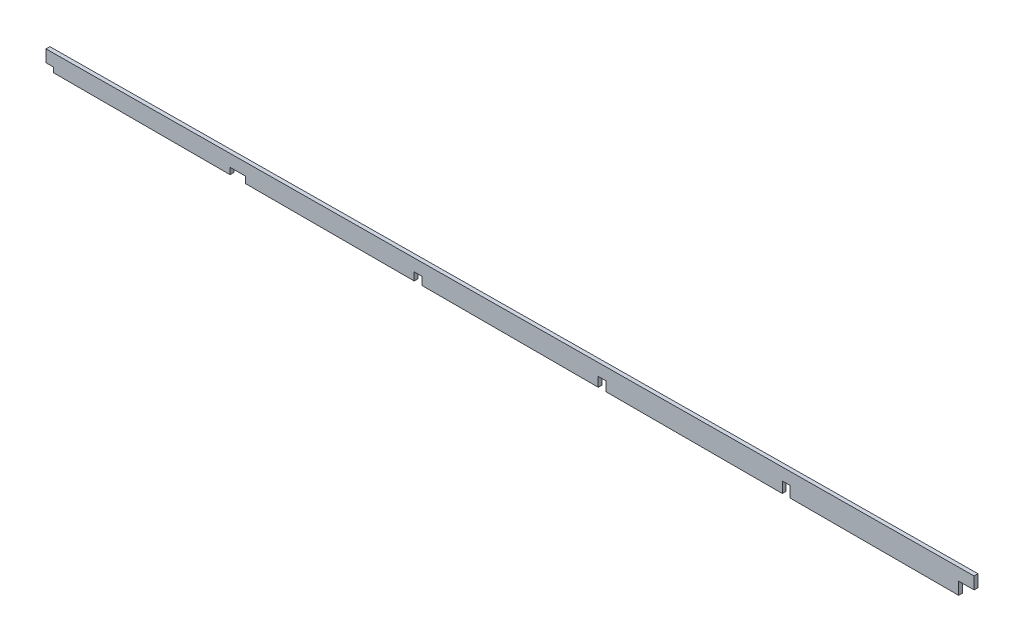
from build123d import *

# Parameters (mm, degrees)
BOSS_EXTRUDE2_DEPTH = 1.5875


with BuildPart() as part:
    # Sketch1 → Boss-Extrude2 (new body)
    with BuildSketch(Plane.XY):
        Polygon((88.325552841, -0.566216396), (88.325552841, 4.406581997), (-292.67444716, 1.291236223), (-292.67444716, -3.664120361), (-289.49944716, -3.638304495), (-289.49944716, -5.670304495), (-217.10944716, -5.670304495), (-217.10944716, -3.049702741), (-210.75944716, -2.998071009), (-210.75944716, -5.670304495), (-141.54444716, -5.670304495), (-141.54444716, -2.435285122), (-138.36944716, -2.409469255), (-138.36944716, -5.670304495), (-65.97944716, -5.670304495), (-65.97944716, -1.820867502), (-62.80444716, -1.795051635), (-62.80444716, -5.670304495), (9.585552841, -5.670304495), (9.585552841, -1.206449882), (12.760552841, -1.180634015), (12.760552841, -5.670304495), (81.975552841, -5.670304495), (81.975552841, -0.617848128), align=None)
    extrude(amount=BOSS_EXTRUDE2_DEPTH)


solid = part.part
